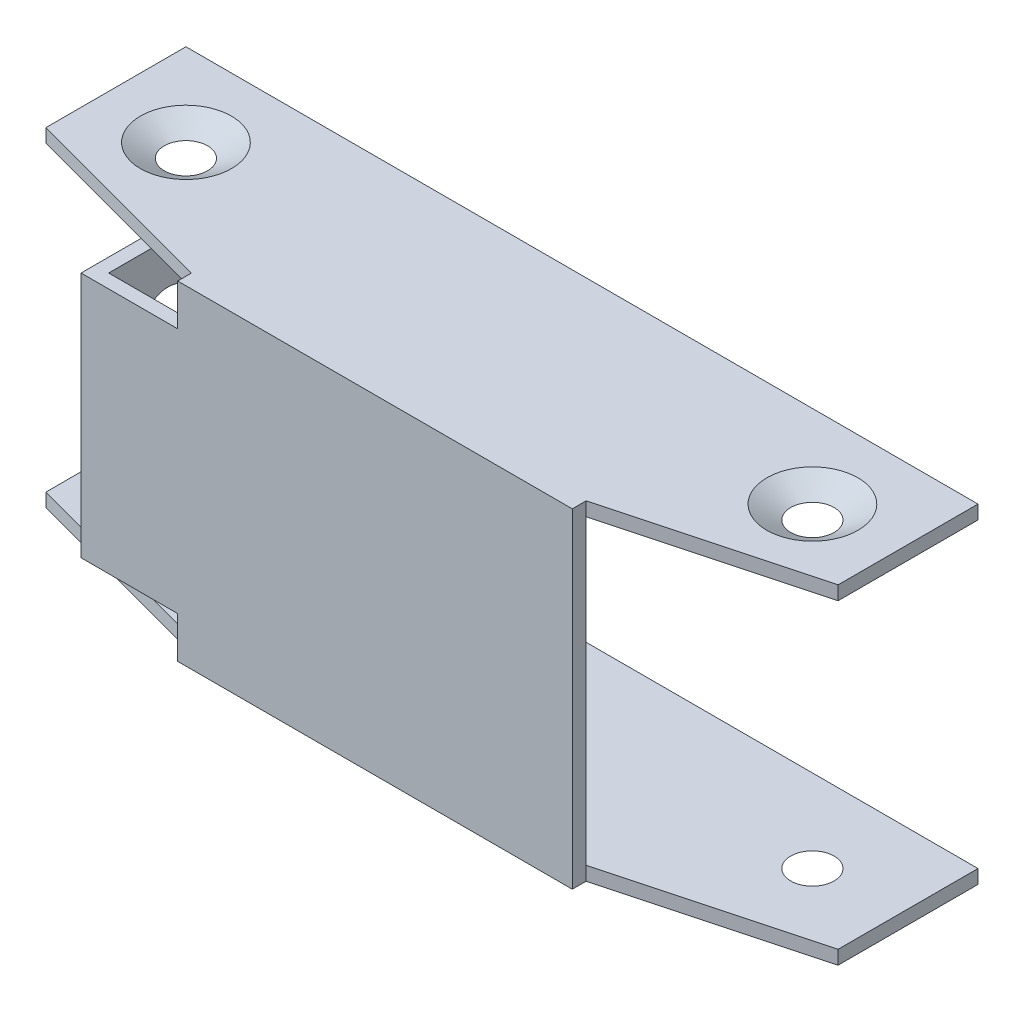
from build123d import *

# Parameters (mm, degrees)
SKETCH1_W                    = 72.898
SKETCH1_H                    = 19.05
SKETCH1_R                    = 4.191
BOSS_EXTRUDE1_DEPTH          = 1.27
SKETCH7_W                    = 72.898
SKETCH7_H                    = 1.27
BOSS_EXTRUDE4_DEPTH          = 30.48
CUT_EXTRUDE2_DEPTH           = 50.267816331
SKETCH10_W                   = 1.27
SKETCH10_H                   = 27.94
BOSS_EXTRUDE5_DEPTH          = 8.89
SKETCH11_W                   = 1.27
SKETCH11_H                   = 27.94
BOSS_EXTRUDE6_DEPTH          = 11.43
SKETCH12_R                   = 2.5
CUT_EXTRUDE3_DEPTH           = 72.631264997
CUT_EXTRUDE5_DEPTH           = 72.631264997
CUT_EXTRUDE5_DEPTH_BACK      = 72.631264997
SKETCH14_W                   = 12.7
SKETCH14_H                   = 5.24
SKETCH15_W                   = 36.322
SKETCH15_H                   = 1.27
BOSS_EXTRUDE8_DEPTH          = 3.81
BOSS_EXTRUDE9_START          = 29.05
BOSS_EXTRUDE9_DEPTH          = 1.27
SKETCH17_R                   = 4.191
CUT_EXTRUDE6_DEPTH           = 1.27
CUT_EXTRUDE6_DRAFT           = -60
CUT_EXTRUDE6_PROFILE_2_DEPTH = 1.27
CUT_EXTRUDE6_PROFILE_2_DRAFT = -60


with BuildPart() as part:
    # Sketch1 → Boss-Extrude1 (new body)
    # profile 1 of 3: a face of its own
    with BuildSketch(Plane(origin=(0, 0, 0), x_dir=(1, 0, 0), z_dir=(0, 1, 0))):
        Rectangle(SKETCH1_W, SKETCH1_H)
        with Locations((28.829, 1.905)):
            Circle(SKETCH1_R, mode=Mode.SUBTRACT)
        with Locations((-28.829, 1.905)):
            Circle(SKETCH1_R, mode=Mode.SUBTRACT)
    # profile 2 of 3: a face of its own
    with BuildSketch(Plane(origin=(0, 0, 0), x_dir=(1, 0, 0), z_dir=(0, 1, 0))):
        with Locations((28.829, 1.905)):
            Circle(SKETCH1_R)
    # profile 3 of 3: a face of its own
    with BuildSketch(Plane(origin=(0, 0, 0), x_dir=(1, 0, 0), z_dir=(0, 1, 0))):
        with Locations((-28.829, 1.905)):
            Circle(SKETCH1_R)
    extrude(amount=BOSS_EXTRUDE1_DEPTH)

    # Cut-Extrude1 cone 1 section (through the dimple's axis) → Cut-Extrude1 (revolve, cut)
    with BuildSketch(Plane(origin=(-28.829, 0, -1.905), x_dir=(0, 0, -1), z_dir=(1, 0, 0))):
        Polygon((0, 0), (4.191, 0), (0, 2.419674978), align=None)
    revolve(axis=Axis((-28.829, 0, -1.905), (0, 1, 0)), mode=Mode.SUBTRACT)

    # Cut-Extrude1 cone 2 section (through the dimple's axis) → Cut-Extrude1 cone 2 (revolve, cut)
    with BuildSketch(Plane(origin=(28.829, 0, -1.905), x_dir=(0, 0, -1), z_dir=(1, 0, 0))):
        Polygon((0, 0), (4.191, 0), (0, 2.419674978), align=None)
    revolve(axis=Axis((28.829, 0, -1.905), (0, 1, 0)), mode=Mode.SUBTRACT)

    # Sketch7 → Boss-Extrude4 (add)
    with BuildSketch(Plane(origin=(0, 1.27, 0), x_dir=(1, 0, 0), z_dir=(0, 1, 0))):
        with Locations((0, -8.89)):
            Rectangle(SKETCH7_W, SKETCH7_H)
    extrude(amount=BOSS_EXTRUDE4_DEPTH)

    # Sketch8 → Cut-Extrude2 (cut, symmetric)
    with BuildSketch(Plane.XZ):
        Polygon((-36.449, 9.525), (-36.449, 3.354745169), (-18.161, 8.255), (-18.161, 9.525), align=None)
    cut_extrude2 = extrude(amount=CUT_EXTRUDE2_DEPTH, both=True, mode=Mode.SUBTRACT)

    # Mirror2: Cut-Extrude2 across plane
    add(cut_extrude2.mirror(Plane.ZY), mode=Mode.SUBTRACT)

    # Sketch10 → Boss-Extrude5 (add)
    with BuildSketch(Plane.ZY.offset(18.161)):
        with Locations((8.89, 17.78)):
            Rectangle(SKETCH10_W, SKETCH10_H)
    extrude(amount=BOSS_EXTRUDE5_DEPTH)

    # Sketch11 → Boss-Extrude6 (add)
    with BuildSketch(Plane(origin=(0, 0, 8.255), x_dir=(-1, 0, 0), z_dir=(0, 0, -1))):
        with Locations((26.416, 17.78)):
            Rectangle(SKETCH11_W, SKETCH11_H)
    extrude(amount=BOSS_EXTRUDE6_DEPTH)

    # Sketch12 → Cut-Extrude3 (cut, through all)
    with BuildSketch(Plane.ZY.offset(27.051)):
        with Locations((2.77876, 10.16)):
            Circle(SKETCH12_R)
        with Locations((2.77876, 20.16)):
            Circle(SKETCH12_R)
    extrude(amount=-CUT_EXTRUDE3_DEPTH, mode=Mode.SUBTRACT)

    # Sketch14 → Cut-Extrude5 (cut, two sides: drawn at the far end of the back side and taken through both)
    with BuildSketch(Plane.ZY.offset(27.051).offset(-CUT_EXTRUDE5_DEPTH_BACK)):
        with Locations((3.175, 29.13)):
            Rectangle(SKETCH14_W, SKETCH14_H)
    extrude(amount=CUT_EXTRUDE5_DEPTH + CUT_EXTRUDE5_DEPTH_BACK, mode=Mode.SUBTRACT)

    # Sketch15 → Boss-Extrude8 (add)
    with BuildSketch(Plane(origin=(0, 26.51, 0), x_dir=(1, 0, 0), z_dir=(0, 1, 0))):
        with Locations((0, -8.89)):
            Rectangle(SKETCH15_W, SKETCH15_H)
    extrude(amount=BOSS_EXTRUDE8_DEPTH)

    # Sketch16 → Boss-Extrude9 (add)
    with BuildSketch(Plane(origin=(0, 1.27, 0), x_dir=(1, 0, 0), z_dir=(0, 1, 0)).offset(BOSS_EXTRUDE9_START)):
        Polygon((-36.449, 9.525), (-36.449, -3.354745169), (-18.161, -8.255), (-18.161, -9.525), (18.161, -9.525), (18.161, -8.255), (36.449, -3.354745169), (36.449, 9.525), align=None)
    extrude(amount=-BOSS_EXTRUDE9_DEPTH)


with BuildPart() as cut_extrude6_tool:
    # Sketch17 → Cut-Extrude6 (with draft: the straight prism first)
    with BuildSketch(Plane(origin=(0, 30.32, 0), x_dir=(1, 0, 0), z_dir=(0, 1, 0))):
        with Locations((-28.829, 1.905)):
            Circle(SKETCH17_R)
    extrude(amount=-CUT_EXTRUDE6_DEPTH)
    # Cut-Extrude6: the draft: its side faces are tilted about the plane it starts from
    cut_extrude6_sides = [cut_extrude6_tool.faces().sort_by_distance(p)[0] for p in [
        (-33.02, 29.685, -1.905),
    ]]
    draft(cut_extrude6_sides, Plane(origin=(0, 30.32, 0), x_dir=(1, 0, 0), z_dir=(0, 1, 0)), CUT_EXTRUDE6_DRAFT)


with BuildPart() as part_1:
    add(part.part)

    # Cut-Extrude6: cut by cut_extrude6_tool
    add(cut_extrude6_tool.part, mode=Mode.SUBTRACT)


with BuildPart() as cut_extrude6_profile_2_tool:
    # Sketch17 → Cut-Extrude6 profile 2 (with draft: the straight prism first)
    with BuildSketch(Plane(origin=(0, 30.32, 0), x_dir=(1, 0, 0), z_dir=(0, 1, 0))):
        with Locations((28.829, 1.905)):
            Circle(SKETCH17_R)
    extrude(amount=-CUT_EXTRUDE6_PROFILE_2_DEPTH)
    # Cut-Extrude6 profile 2: the draft: its side faces are tilted about the plane it starts from
    cut_extrude6_profile_2_sides = [cut_extrude6_profile_2_tool.faces().sort_by_distance(p)[0] for p in [
        (24.638, 29.685, -1.905),
    ]]
    draft(cut_extrude6_profile_2_sides, Plane(origin=(0, 30.32, 0), x_dir=(1, 0, 0), z_dir=(0, 1, 0)), CUT_EXTRUDE6_PROFILE_2_DRAFT)


with BuildPart() as part_2:
    add(part_1.part)

    # Cut-Extrude6 profile 2: cut by cut_extrude6_profile_2_tool
    add(cut_extrude6_profile_2_tool.part, mode=Mode.SUBTRACT)


solid = part_2.part
